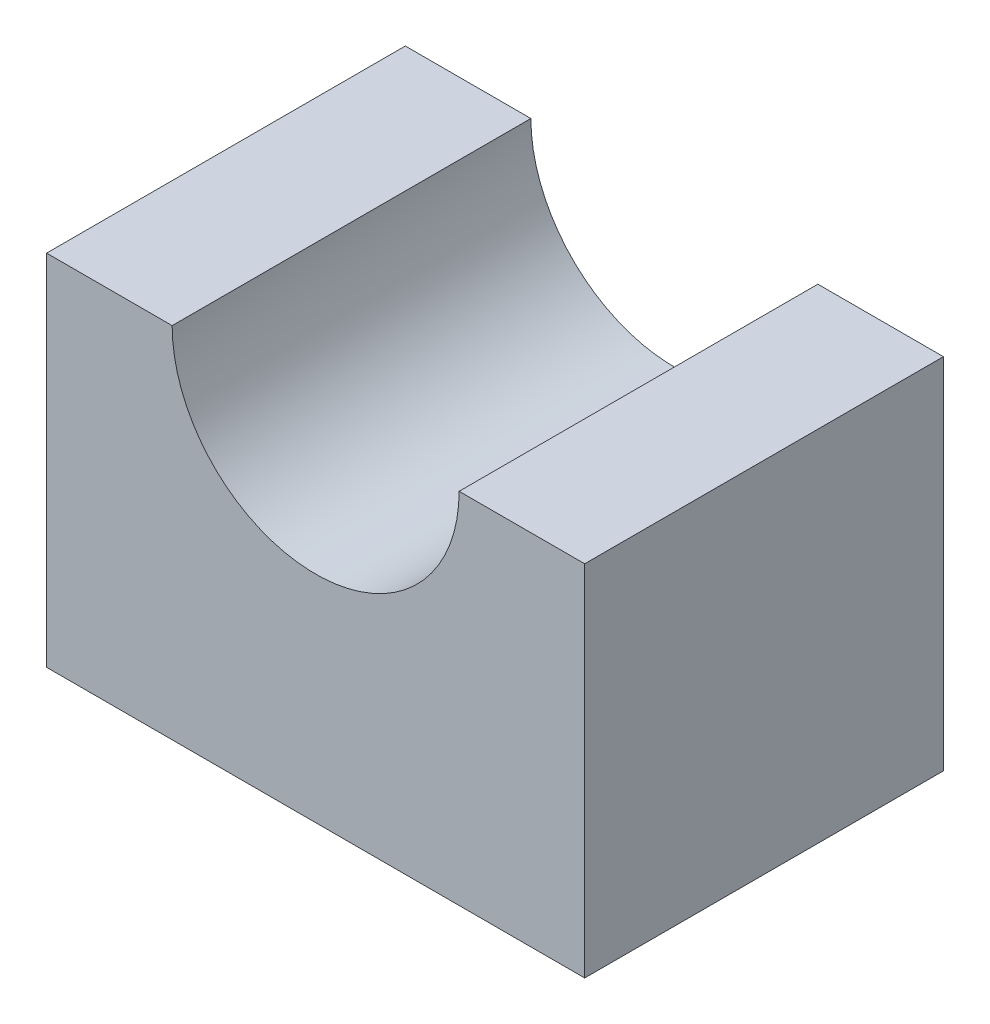
from build123d import *

# Parameters (mm, degrees)
BOSS_EXTRUDE1_DEPTH = 10


with BuildPart() as part:
    # Sketch1 → Boss-Extrude1 (new, symmetric)
    with BuildSketch(Plane.XY):
        with BuildLine():
            Line((8, 0), (15, 0))
            Line((15, 0), (15, -20))
            Line((15, -20), (-15, -20))
            Line((-15, -20), (-15, 0))
            Line((-15, 0), (-8, 0))
            ThreePointArc((-8, 0), (0, -8), (8, 0))
        make_face()
    extrude(amount=BOSS_EXTRUDE1_DEPTH, both=True)


solid = part.part
